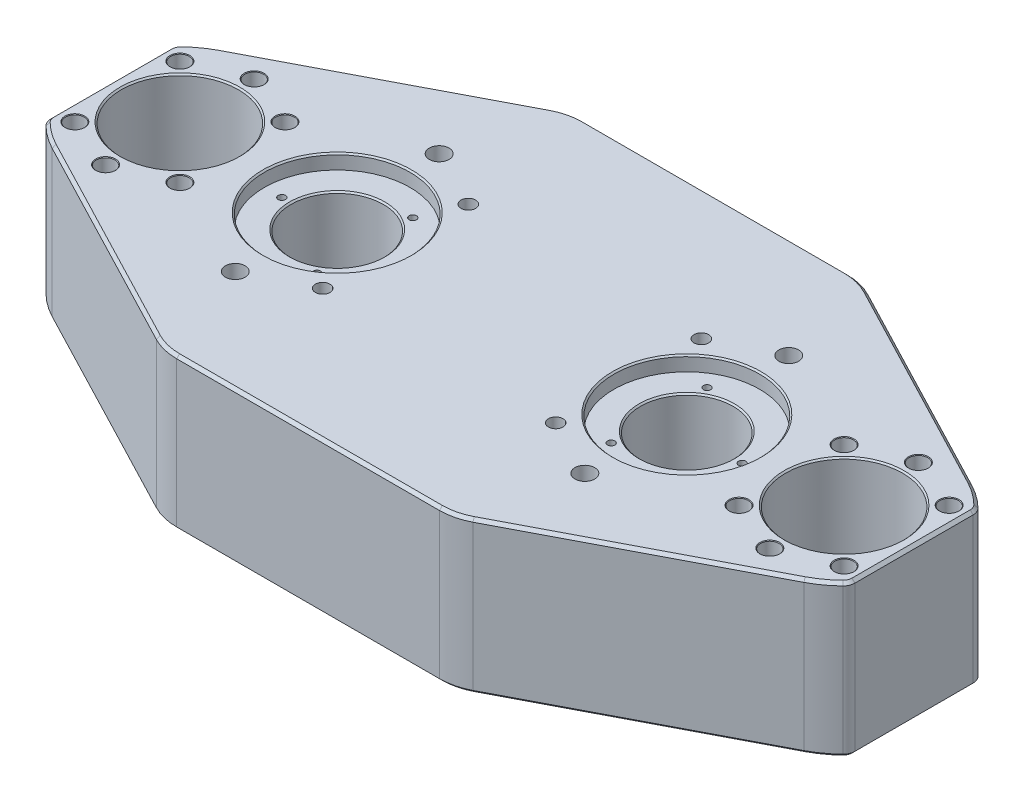
from build123d import *

# Parameters (mm, degrees)
SKETCH1_R                      = 20.1
SKETCH1_R_2                    = 15.875
BOSS_EXTRUDE1_DEPTH            = 26
M6_CLEARANCE_HOLE1_D           = 6.4
CHAMFER2_SIZE                  = 0.5
CHAMFER5_SIZE                  = 1
CHAMFER6_SIZE                  = 0.5
M3X0_5_TAPPED_HOLE1_AT_2_COUNT = 2
M3X0_5_TAPPED_HOLE1_AT_2_PITCH = 32.908965344
M3X0_5_TAPPED_HOLE1_AT_3_COUNT = 2
M3X0_5_TAPPED_HOLE1_AT_3_PITCH = 32.908965344
CHAMFER9_SIZE                  = 0.2
M8X1_25_TAPPED_HOLE1_D         = 6.8
MIRROR9_COPY_1_D               = 6.8
SKETCH17_R                     = 25
CUT_EXTRUDE1_DEPTH             = 5
CHAMFER10_SIZE                 = 0.5
M6X1_0_TAPPED_HOLE1_AT_2_COUNT = 2
M6X1_0_TAPPED_HOLE1_AT_2_PITCH = 50
M6X1_0_TAPPED_HOLE1_AT_3_COUNT = 2
M6X1_0_TAPPED_HOLE1_AT_3_PITCH = 80
M6X1_0_TAPPED_HOLE1_AT_4_COUNT = 2
M6X1_0_TAPPED_HOLE1_AT_4_PITCH = 94.339811321


with BuildPart() as part:
    # Sketch1 → Boss-Extrude1 (new, symmetric)
    with BuildSketch(Plane(origin=(0, 0, 0), x_dir=(1, 0, 0), z_dir=(0, 1, 0))):
        with BuildLine():
            Line((-129.019397533, 28.821306316), (-54.344115966, 67.736188502))
            ThreePointArc((-54.344115966, 67.736188502), (-49.859362606, 69.425804617), (-45.101409792, 70))
            Line((-45.101409792, 70), (45.101409792, 70))
            ThreePointArc((45.101409792, 70), (49.859362606, 69.425804617), (54.344115966, 67.736188502))
            Line((54.344115966, 67.736188502), (129.019397533, 28.821306316))
            ThreePointArc((129.019397533, 28.821306316), (133.124332583, 26.277555123), (136.807017544, 23.153616364))
            ThreePointArc((136.807017544, 23.153616364), (137.689720191, 21.848597396), (138, 20.303940504))
            Line((138, 20.303940504), (138, -20.303940504))
            ThreePointArc((138, -20.303940504), (137.689720191, -21.848597396), (136.807017544, -23.153616364))
            ThreePointArc((136.807017544, -23.153616364), (133.124332583, -26.277555123), (129.019397533, -28.821306316))
            Line((129.019397533, -28.821306316), (54.344115966, -67.736188502))
            ThreePointArc((54.344115966, -67.736188502), (49.859362606, -69.425804617), (45.101409792, -70))
            Line((45.101409792, -70), (-45.101409792, -70))
            ThreePointArc((-45.101409792, -70), (-49.859362606, -69.425804617), (-54.344115966, -67.736188502))
            Line((-54.344115966, -67.736188502), (-129.019397533, -28.821306316))
            ThreePointArc((-129.019397533, -28.821306316), (-133.124332583, -26.277555123), (-136.807017544, -23.153616364))
            ThreePointArc((-136.807017544, -23.153616364), (-137.689720191, -21.848597396), (-138, -20.303940504))
            Line((-138, -20.303940504), (-138, 20.303940504))
            ThreePointArc((-138, 20.303940504), (-137.689720191, 21.848597396), (-136.807017544, 23.153616364))
            ThreePointArc((-136.807017544, 23.153616364), (-133.124332583, 26.277555123), (-129.019397533, 28.821306316))
        make_face()
        with Locations(Location((-114, 0, 0), (0, 0, 90))):
            Circle(SKETCH1_R, mode=Mode.SUBTRACT)
        with Locations(Location((114, 0, 0), (0, 0, 90))):
            Circle(SKETCH1_R, mode=Mode.SUBTRACT)
        with Locations(Location((-60, 0, 0), (0, 0, 90))):
            Circle(SKETCH1_R_2, mode=Mode.SUBTRACT)
        with Locations(Location((60, 0, 0), (0, 0, 90))):
            Circle(SKETCH1_R_2, mode=Mode.SUBTRACT)
    extrude(amount=BOSS_EXTRUDE1_DEPTH, both=True)

    # M6 Clearance Hole1 (through all)
    with Locations(Plane(origin=(0, -26, 0), x_dir=(-1, 0, 0), z_dir=(0, -1, 0))):
        with Locations((-95.96877708, -18.03122292), (-114, -25.5), (-132.03122292, -18.03122292), (-132.03122292, 18.03122292), (-114, 25.5), (-95.96877708, 18.03122292)):
            m6_clearance_hole1 = Hole(M6_CLEARANCE_HOLE1_D / 2)

    # Mirror5: M6 Clearance Hole1 across plane
    add(m6_clearance_hole1.mirror(Plane(origin=(0, 0, 0), x_dir=(0, 0, 1), z_dir=(1, 0, 0))), mode=Mode.SUBTRACT)

    # Chamfer2
    chamfer2_edges = [part.edges().sort_by_distance(p)[0] for p in [
        (-114, -26, 20.1),
        (-114, 26, 20.1),
        (114, -26, 20.1),
        (114, 26, 20.1),
    ]]
    chamfer(chamfer2_edges, length=CHAMFER2_SIZE)

    # Chamfer5
    chamfer5_edges = [part.edges().sort_by_distance(p)[0] for p in [
        (-138, 26, 0),
        (-137.689720191, 26, 21.848597396),
        (-91.68175675, -26, -48.278747409),
        (-49.859362606, -26, -69.425804617),
        (0, -26, -70),
        (49.859362606, -26, -69.425804617),
        (-133.124332583, 26, 26.277555123),
        (91.68175675, -26, -48.278747409),
        (133.124332583, -26, -26.277555123),
        (137.689720191, -26, -21.848597396),
        (138, -26, 0),
        (137.689720191, -26, 21.848597396),
        (133.124332583, -26, 26.277555123),
        (91.68175675, -26, 48.278747409),
        (49.859362606, -26, 69.425804617),
        (0, -26, 70),
        (-49.859362606, -26, 69.425804617),
        (-91.68175675, 26, 48.278747409),
        (-91.68175675, -26, 48.278747409),
        (-133.124332583, -26, 26.277555123),
        (-137.689720191, -26, 21.848597396),
        (-138, -26, 0),
        (-137.689720191, -26, -21.848597396),
        (-133.124332583, -26, -26.277555123),
        (-49.859362606, 26, 69.425804617),
        (0, 26, 70),
        (49.859362606, 26, 69.425804617),
        (91.68175675, 26, 48.278747409),
        (133.124332583, 26, 26.277555123),
        (137.689720191, 26, 21.848597396),
        (-133.124332583, 26, -26.277555123),
        (138, 26, 0),
        (137.689720191, 26, -21.848597396),
        (133.124332583, 26, -26.277555123),
        (91.68175675, 26, -48.278747409),
        (49.859362606, 26, -69.425804617),
        (0, 26, -70),
        (-49.859362606, 26, -69.425804617),
        (-91.68175675, 26, -48.278747409),
        (-137.689720191, 26, -21.848597396),
    ]]
    chamfer(chamfer5_edges, length=CHAMFER5_SIZE)

    # Chamfer6
    chamfer6_edges = [part.edges().sort_by_distance(p)[0] for p in [
        (-60, -26, 15.875),
        (-60, 26, 15.875),
        (60, -26, 15.875),
        (60, 26, 15.875),
    ]]
    chamfer(chamfer6_edges, length=CHAMFER6_SIZE)

    # Sketch13 → M3x0.5 Tapped Hole1 (revolve, cut)
    with BuildSketch(Plane(origin=(79, 26, 0), x_dir=(0, 0, 1), z_dir=(1, 0, 0))):
        Polygon((0, 0), (0, 12.751075774), (1.25, 12), (1.25, 0), align=None)
    m3x0_5_tapped_hole1 = revolve(axis=Axis((79, 32.35, 0), (0, -1, 0)), mode=Mode.SUBTRACT)

    # M3x0.5 Tapped Hole1 at 2: M3x0.5 Tapped Hole1 ×2
    with Locations(*[Vector(-0.8660254037844387, 0, 0.5000000000000001) * (i * M3X0_5_TAPPED_HOLE1_AT_2_PITCH) for i in range(1, M3X0_5_TAPPED_HOLE1_AT_2_COUNT)]):
        add(m3x0_5_tapped_hole1, mode=Mode.SUBTRACT)

    # M3x0.5 Tapped Hole1 at 3: M3x0.5 Tapped Hole1 ×2
    with Locations(*[Vector(-0.8660254037844387, 0, -0.5000000000000001) * (i * M3X0_5_TAPPED_HOLE1_AT_3_PITCH) for i in range(1, M3X0_5_TAPPED_HOLE1_AT_3_COUNT)]):
        add(m3x0_5_tapped_hole1, mode=Mode.SUBTRACT)

    # Mirror6: M3x0.5 Tapped Hole1 across plane
    add(m3x0_5_tapped_hole1.mirror(Plane(origin=(0, 0, 0), x_dir=(0, 0, 1), z_dir=(1, 0, 0))), mode=Mode.SUBTRACT)

    # Mirror6 copy 1 sketch → Mirror6 copy 1 (revolve, cut)
    with BuildSketch(Plane(origin=(-50.5, 26, 16.454482672), x_dir=(0, 0, 1), z_dir=(-1, 0, 0))):
        Polygon((0, 0), (0, -12.751075774), (1.25, -12), (1.25, 0), align=None)
    revolve(axis=Axis((-50.5, 32.35, 16.454482672), (0, 1, 0)), mode=Mode.SUBTRACT)

    # Mirror6 copy 2 sketch → Mirror6 copy 2 (revolve, cut)
    with BuildSketch(Plane(origin=(-50.5, 26, -16.454482672), x_dir=(0, 0, 1), z_dir=(-1, 0, 0))):
        Polygon((0, 0), (0, -12.751075774), (1.25, -12), (1.25, 0), align=None)
    revolve(axis=Axis((-50.5, 32.35, -16.454482672), (0, 1, 0)), mode=Mode.SUBTRACT)

    # Mirror7: M3x0.5 Tapped Hole1 across plane
    add(m3x0_5_tapped_hole1.mirror(Plane.ZX), mode=Mode.SUBTRACT)

    # Mirror7 copy 1 sketch → Mirror7 copy 1 (revolve, cut)
    with BuildSketch(Plane(origin=(50.5, -26, 16.454482672), x_dir=(0, 0, 1), z_dir=(1, 0, 0))):
        Polygon((0, 0), (0, -12.751075774), (1.25, -12), (1.25, 0), align=None)
    revolve(axis=Axis((50.5, -32.35, 16.454482672), (0, -1, 0)), mode=Mode.SUBTRACT)

    # Mirror7 copy 2 sketch → Mirror7 copy 2 (revolve, cut)
    with BuildSketch(Plane(origin=(50.5, -26, -16.454482672), x_dir=(0, 0, 1), z_dir=(1, 0, 0))):
        Polygon((0, 0), (0, -12.751075774), (1.25, -12), (1.25, 0), align=None)
    revolve(axis=Axis((50.5, -32.35, -16.454482672), (0, -1, 0)), mode=Mode.SUBTRACT)

    # Mirror7 copy 3 sketch → Mirror7 copy 3 (revolve, cut)
    with BuildSketch(Plane(origin=(-79, -26, 0), x_dir=(0, 0, 1), z_dir=(-1, 0, 0))):
        Polygon((0, 0), (0, 12.751075774), (1.25, 12), (1.25, 0), align=None)
    revolve(axis=Axis((-79, -32.35, 0), (0, 1, 0)), mode=Mode.SUBTRACT)

    # Mirror7 copy 4 sketch → Mirror7 copy 4 (revolve, cut)
    with BuildSketch(Plane(origin=(-50.5, -26, 16.454482672), x_dir=(0, 0, 1), z_dir=(-1, 0, 0))):
        Polygon((0, 0), (0, 12.751075774), (1.25, 12), (1.25, 0), align=None)
    revolve(axis=Axis((-50.5, -32.35, 16.454482672), (0, 1, 0)), mode=Mode.SUBTRACT)

    # Mirror7 copy 5 sketch → Mirror7 copy 5 (revolve, cut)
    with BuildSketch(Plane(origin=(-50.5, -26, -16.454482672), x_dir=(0, 0, 1), z_dir=(-1, 0, 0))):
        Polygon((0, 0), (0, 12.751075774), (1.25, 12), (1.25, 0), align=None)
    revolve(axis=Axis((-50.5, -32.35, -16.454482672), (0, 1, 0)), mode=Mode.SUBTRACT)

    # Chamfer9
    chamfer9_edges = [part.edges().sort_by_distance(p)[0] for p in [
        (110.8, -26, 25.5),
        (110.8, 26, 25.5),
        (92.76877708, -26, 18.03122292),
        (92.76877708, 26, 18.03122292),
        (-92.76877708, -26, -18.03122292),
        (-92.76877708, 26, -18.03122292),
        (-110.8, -26, -25.5),
        (-110.8, 26, -25.5),
        (-128.83122292, -26, -18.03122292),
        (-128.83122292, 26, -18.03122292),
        (-128.83122292, -26, 18.03122292),
        (-128.83122292, 26, 18.03122292),
        (-110.8, -26, 25.5),
        (-110.8, 26, 25.5),
        (-92.76877708, -26, 18.03122292),
        (-92.76877708, 26, 18.03122292),
        (92.76877708, -26, -18.03122292),
        (92.76877708, 26, -18.03122292),
        (110.8, -26, -25.5),
        (110.8, 26, -25.5),
        (128.83122292, -26, -18.03122292),
        (128.83122292, 26, -18.03122292),
        (128.83122292, -26, 18.03122292),
        (128.83122292, 26, 18.03122292),
    ]]
    chamfer(chamfer9_edges, length=CHAMFER9_SIZE)

    # M8x1.25 Tapped Hole1 (through all)
    with Locations(Plane.XZ.offset(26)):
        with Locations((-60, -35)):
            m8x1_25_tapped_hole1 = Hole(M8X1_25_TAPPED_HOLE1_D / 2)

    # Mirror8: M8x1.25 Tapped Hole1 across plane
    add(m8x1_25_tapped_hole1.mirror(Plane.XY), mode=Mode.SUBTRACT)

    # Mirror9: M8x1.25 Tapped Hole1 across plane
    add(m8x1_25_tapped_hole1.mirror(Plane(origin=(0, 0, 0), x_dir=(0, 0, 1), z_dir=(1, 0, 0))), mode=Mode.SUBTRACT)

    # Mirror9 copy 1 (through all)
    with Locations(Plane(origin=(0, -26, 0), x_dir=(-1, 0, 0), z_dir=(0, -1, 0))):
        with Locations((-60, -35)):
            Hole(MIRROR9_COPY_1_D / 2)

    # Sketch17 → Cut-Extrude1 (cut)
    with BuildSketch(Plane(origin=(0, 26, 0), x_dir=(1, 0, 0), z_dir=(0, 1, 0))):
        with Locations(Location((60, 0, 0), (0, 0, 270))):
            Circle(SKETCH17_R)
        with Locations(Location((-60, 0, 0), (0, 0, 270))):
            Circle(SKETCH17_R)
    cut_extrude1 = extrude(amount=-CUT_EXTRUDE1_DEPTH, mode=Mode.SUBTRACT)

    # Mirror10: Cut-Extrude1 across plane
    add(cut_extrude1.mirror(Plane.ZX), mode=Mode.SUBTRACT)

    # Chamfer10
    chamfer10_edges = [part.edges().sort_by_distance(p)[0] for p in [
        (60, 21, 15.875),
        (60, 26, -25),
        (-60, 21, 15.875),
        (-60, 26, -25),
        (60, -21, 15.875),
        (60, -26, -25),
        (-60, -21, 15.875),
        (-60, -26, -25),
    ]]
    chamfer(chamfer10_edges, length=CHAMFER10_SIZE)

    # Sketch20 → M6x1.0 Tapped Hole1 (revolve, cut)
    with BuildSketch(Plane(origin=(-40, -26, -25), x_dir=(0, 0, -1), z_dir=(1, 0, 0))):
        Polygon((0, 0), (0, 16.502151548), (2.5, 15), (2.5, 0), align=None)
    m6x1_0_tapped_hole1 = revolve(axis=Axis((-40, -32.35, -25), (0, 1, 0)), mode=Mode.SUBTRACT)

    # M6x1.0 Tapped Hole1 at 2: M6x1.0 Tapped Hole1 ×2
    with Locations(*[(0, 0, i * M6X1_0_TAPPED_HOLE1_AT_2_PITCH) for i in range(1, M6X1_0_TAPPED_HOLE1_AT_2_COUNT)]):
        add(m6x1_0_tapped_hole1, mode=Mode.SUBTRACT)

    # M6x1.0 Tapped Hole1 at 3: M6x1.0 Tapped Hole1 ×2
    with Locations(*[(i * M6X1_0_TAPPED_HOLE1_AT_3_PITCH, 0, 0) for i in range(1, M6X1_0_TAPPED_HOLE1_AT_3_COUNT)]):
        add(m6x1_0_tapped_hole1, mode=Mode.SUBTRACT)

    # M6x1.0 Tapped Hole1 at 4: M6x1.0 Tapped Hole1 ×2
    with Locations(*[Vector(0.847998304005088, 0, 0.52999894000318) * (i * M6X1_0_TAPPED_HOLE1_AT_4_PITCH) for i in range(1, M6X1_0_TAPPED_HOLE1_AT_4_COUNT)]):
        add(m6x1_0_tapped_hole1, mode=Mode.SUBTRACT)

    # Mirror11: M6x1.0 Tapped Hole1 across plane
    add(m6x1_0_tapped_hole1.mirror(Plane.ZX), mode=Mode.SUBTRACT)

    # Mirror11 copy 1 sketch → Mirror11 copy 1 (revolve, cut)
    with BuildSketch(Plane(origin=(-40, 26, 25), x_dir=(0, 0, -1), z_dir=(1, 0, 0))):
        Polygon((0, 0), (0, -16.502151548), (2.5, -15), (2.5, 0), align=None)
    revolve(axis=Axis((-40, 32.35, 25), (0, 1, 0)), mode=Mode.SUBTRACT)

    # Mirror11 copy 2 sketch → Mirror11 copy 2 (revolve, cut)
    with BuildSketch(Plane(origin=(40, 26, -25), x_dir=(0, 0, -1), z_dir=(1, 0, 0))):
        Polygon((0, 0), (0, -16.502151548), (2.5, -15), (2.5, 0), align=None)
    revolve(axis=Axis((40, 32.35, -25), (0, 1, 0)), mode=Mode.SUBTRACT)

    # Mirror11 copy 3 sketch → Mirror11 copy 3 (revolve, cut)
    with BuildSketch(Plane(origin=(40, 26, 25), x_dir=(0, 0, -1), z_dir=(1, 0, 0))):
        Polygon((0, 0), (0, -16.502151548), (2.5, -15), (2.5, 0), align=None)
    revolve(axis=Axis((40, 32.35, 25), (0, 1, 0)), mode=Mode.SUBTRACT)


solid = part.part
